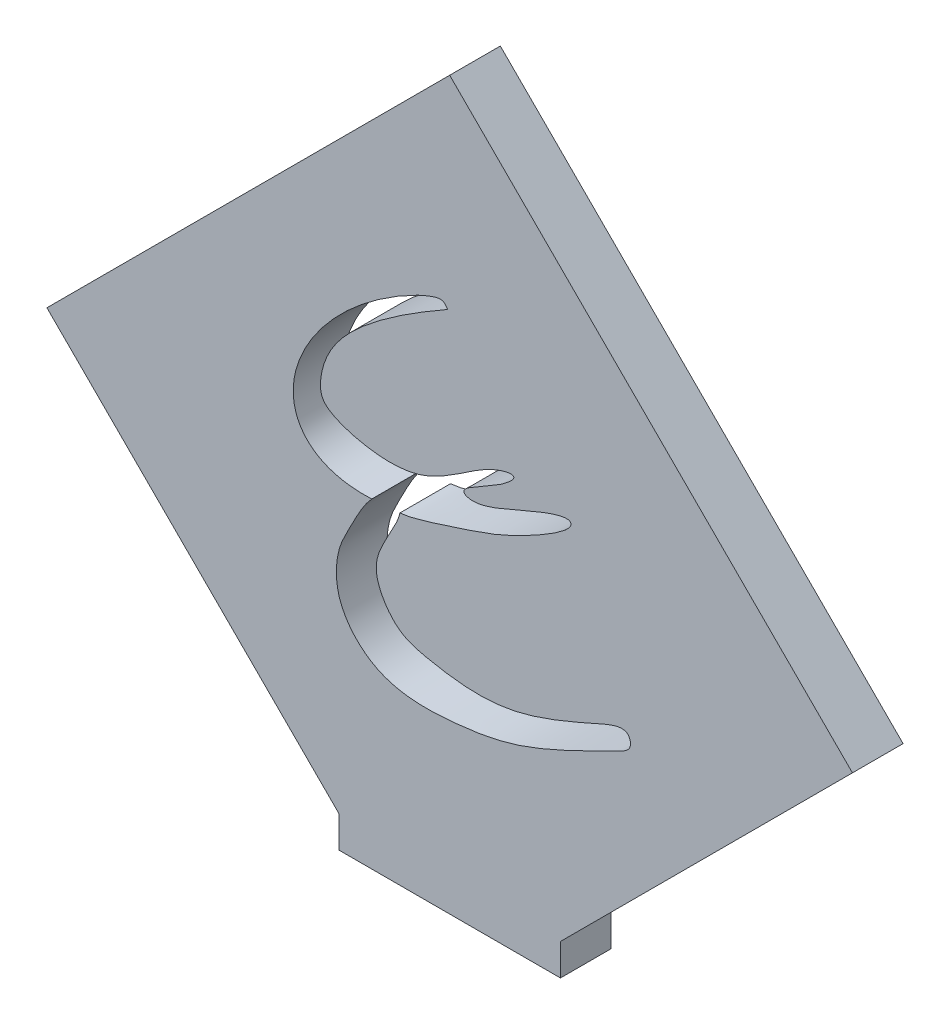
from build123d import *

# Parameters (mm, degrees)
BOSS_EXTRU_1_DEPTH = 8


with BuildPart() as part:
    # Esquisse1 → Boss.-Extru.1 (new body)
    with BuildSketch(Plane.XY):
        Polygon((-63.708944389, 0.069334083), (-0.069334083, 63.708944389), (63.570276224, 0.069334083), (17.430665917, -46.070276224), (17.430665917, -51.070276224), (-17.569334083, -51.070276224), (-17.569334083, -46.070276224), align=None)
        with BuildLine():
            add(Edge.make_bspline(
                [(-5.115506028, 31.092505827), (-74.694459112, -3.606886106), (-12.382495372, -0.431708683)],
                knots=[1.410712411, 1.410712411, 1.410712411, 3.915416826, 3.915416826, 3.915416826], degree=2, weights=[1, 0.313089284, 1]))
            add(Edge.make_bspline(
                [(-12.382495372, -0.431708683), (-13.798602233, -1.970552148), (-15.786840747, -6.093599789), (-17.940553431, -9.873120011), (-18.348737285, -16.874055848), (-13.35081833, -22.995859006), (-6.551642351, -25.057550692), (1.88103916, -24.54591103), (11.779109088, -22.952544083), (25.00486663, -16.185562888), (28.93948729, -14.389823467), (27.993312927, -11.156439401), (21.757162276, -14.090338296), (11.130064297, -18.590558204), (2.767957215, -18.957941955), (-3.459000654, -17.906487015), (-8.243969802, -16.724430253), (-11.601072215, -11.981967102), (-12.081798673, -7.193307921), (-8.193031016, -1.811604891), (-7.944443591, -0.123954778)],
                knots=[0, 0, 0, 0, 0.055002772, 0.100403302, 0.155063967, 0.213544692, 0.269816807, 0.331098512, 0.40122397, 0.4846289, 0.525512756, 0.554104146, 0.605282305, 0.680677294, 0.743040173, 0.796469745, 0.843344101, 0.892769378, 0.939894922, 1, 1, 1, 1], degree=3))
            add(Edge.make_bspline(
                [(-7.944443591, -0.123954778), (-7.355485291, -0.044657406), (-6.159288188, 0.003625087), (4.433180118, 3.371139171), (10.650732833, 5.809626431), (19.065659667, 10.677830295), (19.240467565, 12.799023311), (13.141600505, 10.975704887), (4.674891636, 6.56121877), (0.720157357, 8.026670784), (7.346889981, 10.915463592), (11.580403861, 14.638267723), (4.786512631, 13.05436648), (-3.974094832, 4.910405782), (-15.540112794, 6.450316743), (-19.941103743, 8.608999059), (-20.803937019, 11.068864087), (-19.172564933, 19.297278514), (-9.05358027, 26.570971255), (-0.399660554, 31.494069393)],
                knots=[0, 0, 0, 0, 0.031255995, 0.106776575, 0.174945069, 0.245285901, 0.267297915, 0.321808442, 0.398015463, 0.429947782, 0.48817775, 0.533801632, 0.581225243, 0.664297247, 0.742642388, 0.792032505, 0.826166158, 0.887072183, 1, 1, 1, 1], degree=3))
            add(Edge.make_bspline(
                [(-5.115506028, 31.092505827), (-3.588520618, 31.784073976), (-1.239792884, 32.841087965), (-0.618855633, 31.848447969), (-0.399660554, 31.494069393)],
                knots=[0, 0, 0, 0, 0.648929767, 1, 1, 1, 1], degree=3))
        make_face(mode=Mode.SUBTRACT)
    extrude(amount=BOSS_EXTRU_1_DEPTH)


solid = part.part
